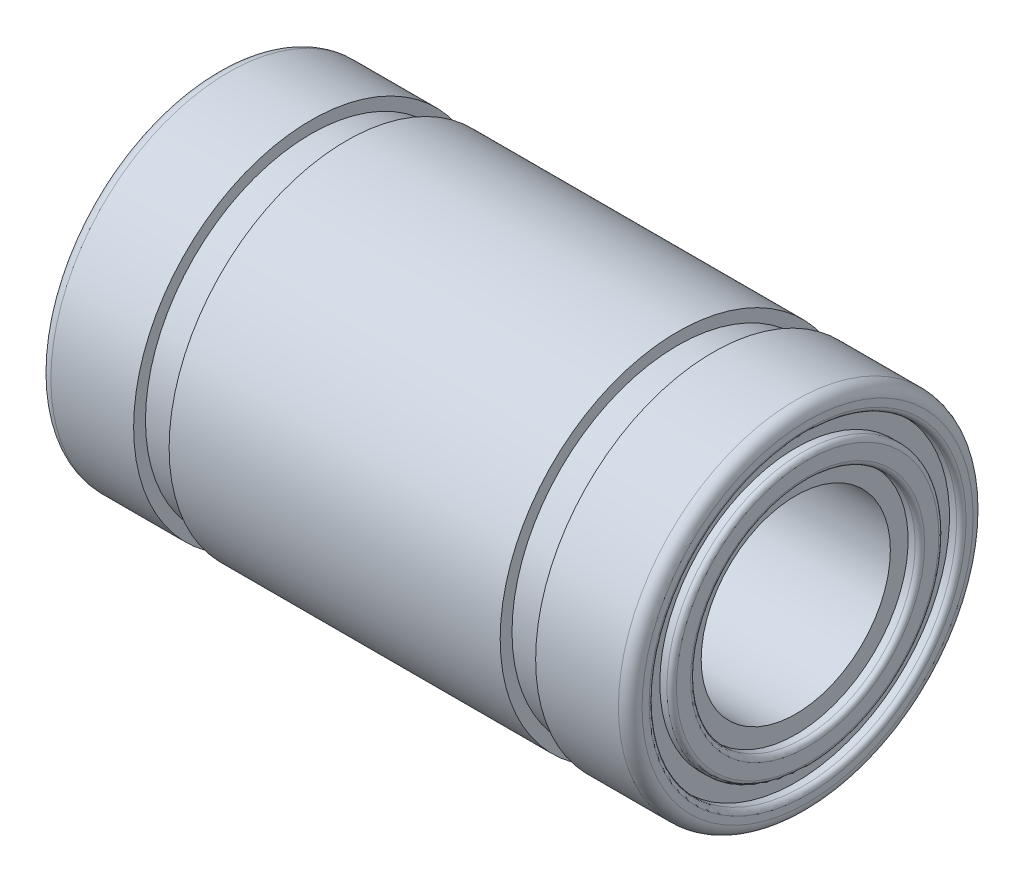
from build123d import *

# Parameters (mm, degrees)
SKETCH2_R          = 4
CUT_EXTRUDE1_DEPTH = 52
FILLET1_R          = 0.5
FILLET2_R          = 0.2


with BuildPart() as part:
    # Sketch1 → Revolve1 (revolve)
    with BuildSketch(Plane.XY, mode=Mode.PRIVATE) as revolve1_sk:
        Polygon((25, 6.5), (24.5, 6.5), (24.5, 5.75), (25, 5.75), (25, 4.75), (24.5, 4.75), (24.5, 4), (25, 4), (25, 0), (0, 0), (0, 4), (0.5, 4), (0.5, 4.75), (0, 4.75), (0, 5.75), (0.5, 5.75), (0.5, 6.5), (0, 6.5), (0, 7.5), (4, 7.5), (4, 7), (5.5, 7), (5.5, 7.5), (19.5, 7.5), (19.5, 7), (21, 7), (21, 7.5), (25, 7.5), align=None)
    revolve(revolve1_sk.sketch.rotate(Axis((0, 0, 0), (1, 0, 0)), 90), axis=Axis((0, 0, 0), (1, 0, 0)))

    # Sketch2 → Cut-Extrude1 (cut)
    with BuildSketch(Plane(origin=(25, 0, 0), x_dir=(0, 0, -1), z_dir=(1, 0, 0))):
        Circle(SKETCH2_R)
    extrude(amount=-CUT_EXTRUDE1_DEPTH, mode=Mode.SUBTRACT)

    # Fillet1
    fillet1_edges = [part.edges().sort_by_distance(p)[0] for p in [
        (0, 0, -7.5),
        (25, 0, -7.5),
    ]]
    fillet(fillet1_edges, radius=FILLET1_R)

    # Fillet2
    fillet2_edges = [part.edges().sort_by_distance(p)[0] for p in [
        (0, 0, -4.75),
        (0, 0, -5.75),
        (0, 0, -6.5),
        (25, 0, -6.5),
        (25, 0, -5.75),
        (25, 0, -4.75),
    ]]
    fillet(fillet2_edges, radius=FILLET2_R)


solid = part.part
